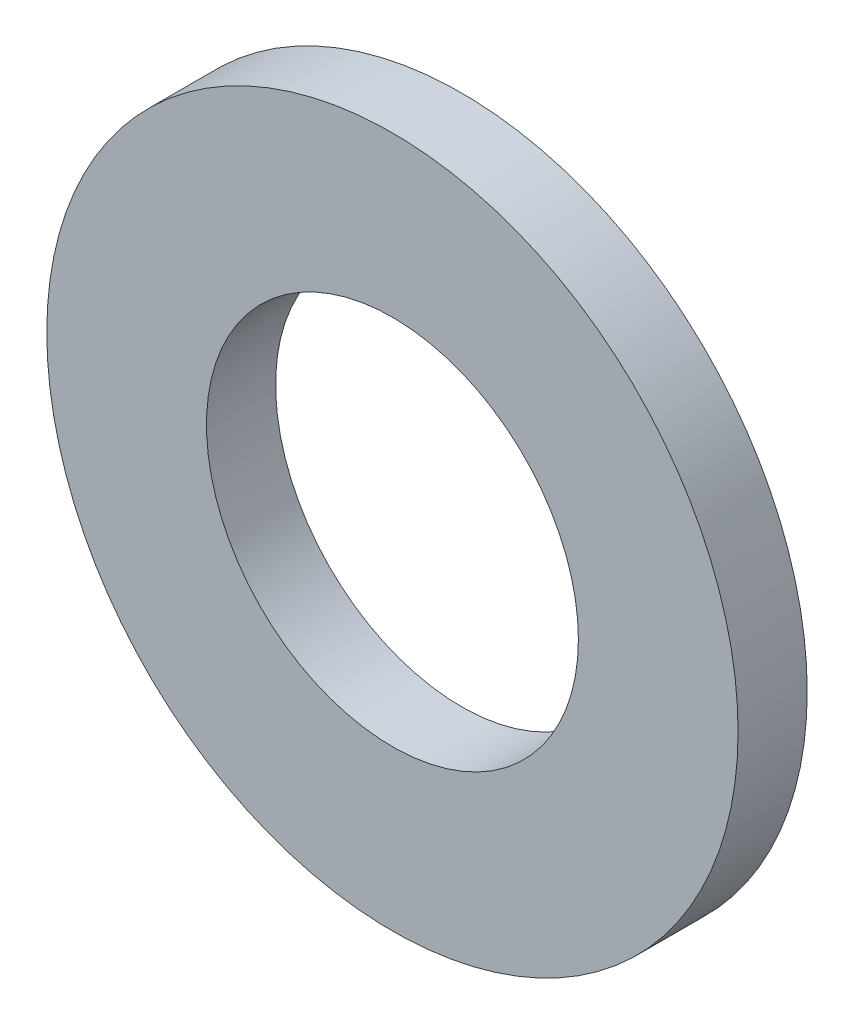
from build123d import *

# Parameters (mm, degrees)
SKETCH_1_R      = 2.5
SKETCH_1_R_2    = 1.345
EXTRUDE_1_DEPTH = 0.5


with BuildPart() as part:
    # Эскиз1 → Бобышка-Вытянуть1 (new body)
    with BuildSketch(Plane.XY):
        Circle(SKETCH_1_R)
        Circle(SKETCH_1_R_2, mode=Mode.SUBTRACT)
    extrude(amount=-EXTRUDE_1_DEPTH)


solid = part.part
